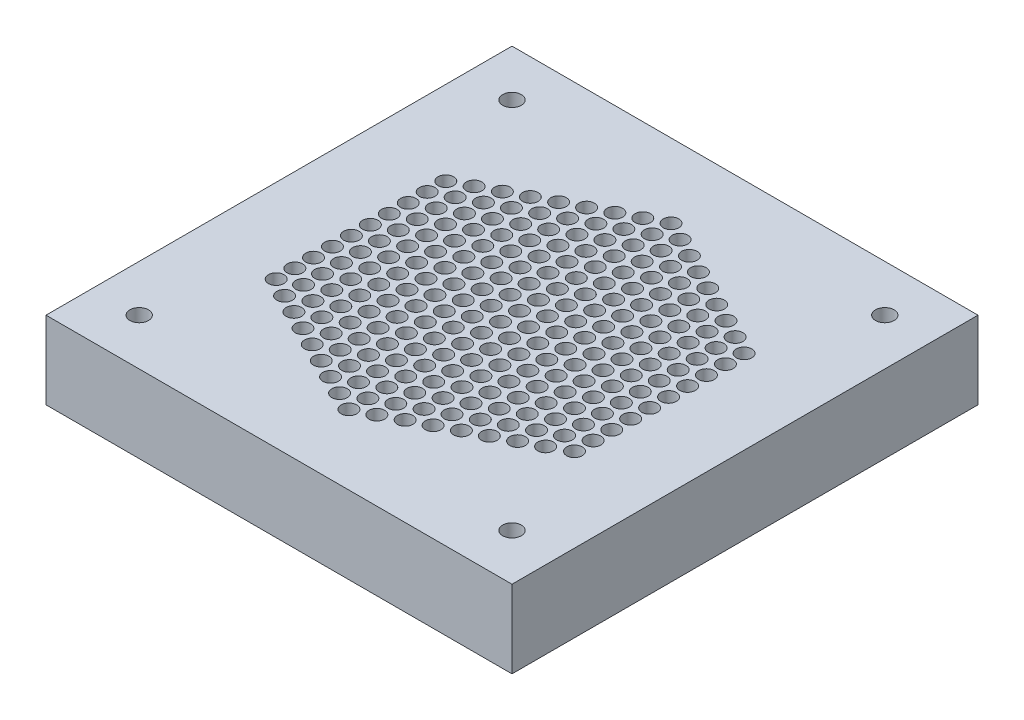
from build123d import *

# Parameters (mm, degrees)
SKETCH1_W        = 150
SKETCH1_H        = 150
SKETCH1_R        = 2.5
EXTRUSION2_DEPTH = 25
SKETCH2_R        = 3
EXTRUSION3_DEPTH = 25


with BuildPart() as part:
    # Sketch1 → Extrusion2 (new body)
    with BuildSketch(Plane(origin=(0, 0, 0), x_dir=(-1, 0, 0), z_dir=(0, 1, 0))):
        Rectangle(SKETCH1_W, SKETCH1_H)
        with Locations(Location((0, 52.5, 0), (0, 0, 90))):
            Circle(SKETCH1_R, mode=Mode.SUBTRACT)
        with Locations(Location((0, 46.4, 0), (0, 0, 90))):
            Circle(SKETCH1_R, mode=Mode.SUBTRACT)
        with Locations(Location((0, 40.3, 0), (0, 0, 90))):
            Circle(SKETCH1_R, mode=Mode.SUBTRACT)
        with Locations(Location((0, 34.2, 0), (0, 0, 90))):
            Circle(SKETCH1_R, mode=Mode.SUBTRACT)
        with Locations(Location((0, 28.1, 0), (0, 0, 90))):
            Circle(SKETCH1_R, mode=Mode.SUBTRACT)
        with Locations(Location((0, 22, 0), (0, 0, 90))):
            Circle(SKETCH1_R, mode=Mode.SUBTRACT)
        with Locations(Location((0, 15.9, 0), (0, 0, 90))):
            Circle(SKETCH1_R, mode=Mode.SUBTRACT)
        with Locations(Location((0, 9.8, 0), (0, 0, 90))):
            Circle(SKETCH1_R, mode=Mode.SUBTRACT)
        with Locations(Location((0, 3.7, 0), (0, 0, 90))):
            Circle(SKETCH1_R, mode=Mode.SUBTRACT)
        with Locations(Location((0, -2.4, 0), (0, 0, 90))):
            Circle(SKETCH1_R, mode=Mode.SUBTRACT)
        with Locations(Location((0, -8.5, 0), (0, 0, 90))):
            Circle(SKETCH1_R, mode=Mode.SUBTRACT)
        with Locations(Location((0, -14.6, 0), (0, 0, 90))):
            Circle(SKETCH1_R, mode=Mode.SUBTRACT)
        with Locations(Location((0, -20.7, 0), (0, 0, 90))):
            Circle(SKETCH1_R, mode=Mode.SUBTRACT)
        with Locations(Location((0, -26.8, 0), (0, 0, 90))):
            Circle(SKETCH1_R, mode=Mode.SUBTRACT)
        with Locations(Location((0, -32.9, 0), (0, 0, 90))):
            Circle(SKETCH1_R, mode=Mode.SUBTRACT)
        with Locations(Location((0, -39, 0), (0, 0, 90))):
            Circle(SKETCH1_R, mode=Mode.SUBTRACT)
        with Locations(Location((0, -45.1, 0), (0, 0, 90))):
            Circle(SKETCH1_R, mode=Mode.SUBTRACT)
        with Locations(Location((0, -51.2, 0), (0, 0, 90))):
            Circle(SKETCH1_R, mode=Mode.SUBTRACT)
        with Locations(Location((6, -35.9, 0), (0, 0, 90))):
            Circle(SKETCH1_R, mode=Mode.SUBTRACT)
        with Locations(Location((6, -29.8, 0), (0, 0, 90))):
            Circle(SKETCH1_R, mode=Mode.SUBTRACT)
        with Locations(Location((6, -42, 0), (0, 0, 90))):
            Circle(SKETCH1_R, mode=Mode.SUBTRACT)
        with Locations(Location((6, -48.1, 0), (0, 0, 90))):
            Circle(SKETCH1_R, mode=Mode.SUBTRACT)
        with Locations(Location((6, -23.7, 0), (0, 0, 90))):
            Circle(SKETCH1_R, mode=Mode.SUBTRACT)
        with Locations(Location((6, -17.6, 0), (0, 0, 90))):
            Circle(SKETCH1_R, mode=Mode.SUBTRACT)
        with Locations(Location((6, -11.5, 0), (0, 0, 90))):
            Circle(SKETCH1_R, mode=Mode.SUBTRACT)
        with Locations(Location((6, -5.4, 0), (0, 0, 90))):
            Circle(SKETCH1_R, mode=Mode.SUBTRACT)
        with Locations(Location((6, 0.7, 0), (0, 0, 90))):
            Circle(SKETCH1_R, mode=Mode.SUBTRACT)
        with Locations(Location((6, 19, 0), (0, 0, 90))):
            Circle(SKETCH1_R, mode=Mode.SUBTRACT)
        with Locations(Location((6, 12.9, 0), (0, 0, 90))):
            Circle(SKETCH1_R, mode=Mode.SUBTRACT)
        with Locations(Location((6, 6.8, 0), (0, 0, 90))):
            Circle(SKETCH1_R, mode=Mode.SUBTRACT)
        with Locations(Location((6, 37.3, 0), (0, 0, 90))):
            Circle(SKETCH1_R, mode=Mode.SUBTRACT)
        with Locations(Location((6, 31.2, 0), (0, 0, 90))):
            Circle(SKETCH1_R, mode=Mode.SUBTRACT)
        with Locations(Location((6, 25.1, 0), (0, 0, 90))):
            Circle(SKETCH1_R, mode=Mode.SUBTRACT)
        with Locations(Location((6, 43.4, 0), (0, 0, 90))):
            Circle(SKETCH1_R, mode=Mode.SUBTRACT)
        with Locations(Location((6, 49.5, 0), (0, 0, 90))):
            Circle(SKETCH1_R, mode=Mode.SUBTRACT)
        with Locations(Location((18, -23.7, 0), (0, 0, 90))):
            Circle(SKETCH1_R, mode=Mode.SUBTRACT)
        with Locations(Location((18, -35.9, 0), (0, 0, 90))):
            Circle(SKETCH1_R, mode=Mode.SUBTRACT)
        with Locations(Location((18, -29.8, 0), (0, 0, 90))):
            Circle(SKETCH1_R, mode=Mode.SUBTRACT)
        with Locations(Location((18, -42, 0), (0, 0, 90))):
            Circle(SKETCH1_R, mode=Mode.SUBTRACT)
        with Locations(Location((18, -11.5, 0), (0, 0, 90))):
            Circle(SKETCH1_R, mode=Mode.SUBTRACT)
        with Locations(Location((18, -17.6, 0), (0, 0, 90))):
            Circle(SKETCH1_R, mode=Mode.SUBTRACT)
        with Locations(Location((18, -5.4, 0), (0, 0, 90))):
            Circle(SKETCH1_R, mode=Mode.SUBTRACT)
        with Locations(Location((18, 0.7, 0), (0, 0, 90))):
            Circle(SKETCH1_R, mode=Mode.SUBTRACT)
        with Locations(Location((18, 6.8, 0), (0, 0, 90))):
            Circle(SKETCH1_R, mode=Mode.SUBTRACT)
        with Locations(Location((18, 12.9, 0), (0, 0, 90))):
            Circle(SKETCH1_R, mode=Mode.SUBTRACT)
        with Locations(Location((18, 25.1, 0), (0, 0, 90))):
            Circle(SKETCH1_R, mode=Mode.SUBTRACT)
        with Locations(Location((18, 31.2, 0), (0, 0, 90))):
            Circle(SKETCH1_R, mode=Mode.SUBTRACT)
        with Locations(Location((18, 37.3, 0), (0, 0, 90))):
            Circle(SKETCH1_R, mode=Mode.SUBTRACT)
        with Locations(Location((18, 43.4, 0), (0, 0, 90))):
            Circle(SKETCH1_R, mode=Mode.SUBTRACT)
        with Locations(Location((18, 19, 0), (0, 0, 90))):
            Circle(SKETCH1_R, mode=Mode.SUBTRACT)
        with Locations(Location((30, -23.7, 0), (0, 0, 90))):
            Circle(SKETCH1_R, mode=Mode.SUBTRACT)
        with Locations(Location((30, -35.9, 0), (0, 0, 90))):
            Circle(SKETCH1_R, mode=Mode.SUBTRACT)
        with Locations(Location((30, -29.8, 0), (0, 0, 90))):
            Circle(SKETCH1_R, mode=Mode.SUBTRACT)
        with Locations(Location((30, -11.5, 0), (0, 0, 90))):
            Circle(SKETCH1_R, mode=Mode.SUBTRACT)
        with Locations(Location((30, -17.6, 0), (0, 0, 90))):
            Circle(SKETCH1_R, mode=Mode.SUBTRACT)
        with Locations(Location((30, -5.4, 0), (0, 0, 90))):
            Circle(SKETCH1_R, mode=Mode.SUBTRACT)
        with Locations(Location((30, 0.7, 0), (0, 0, 90))):
            Circle(SKETCH1_R, mode=Mode.SUBTRACT)
        with Locations(Location((30, 6.8, 0), (0, 0, 90))):
            Circle(SKETCH1_R, mode=Mode.SUBTRACT)
        with Locations(Location((30, 12.9, 0), (0, 0, 90))):
            Circle(SKETCH1_R, mode=Mode.SUBTRACT)
        with Locations(Location((30, 25.1, 0), (0, 0, 90))):
            Circle(SKETCH1_R, mode=Mode.SUBTRACT)
        with Locations(Location((30, 31.2, 0), (0, 0, 90))):
            Circle(SKETCH1_R, mode=Mode.SUBTRACT)
        with Locations(Location((30, 37.3, 0), (0, 0, 90))):
            Circle(SKETCH1_R, mode=Mode.SUBTRACT)
        with Locations(Location((30, 19, 0), (0, 0, 90))):
            Circle(SKETCH1_R, mode=Mode.SUBTRACT)
        with Locations(Location((42, -23.7, 0), (0, 0, 90))):
            Circle(SKETCH1_R, mode=Mode.SUBTRACT)
        with Locations(Location((42, -29.8, 0), (0, 0, 90))):
            Circle(SKETCH1_R, mode=Mode.SUBTRACT)
        with Locations(Location((42, -11.5, 0), (0, 0, 90))):
            Circle(SKETCH1_R, mode=Mode.SUBTRACT)
        with Locations(Location((42, -17.6, 0), (0, 0, 90))):
            Circle(SKETCH1_R, mode=Mode.SUBTRACT)
        with Locations(Location((42, -5.4, 0), (0, 0, 90))):
            Circle(SKETCH1_R, mode=Mode.SUBTRACT)
        with Locations(Location((42, 0.7, 0), (0, 0, 90))):
            Circle(SKETCH1_R, mode=Mode.SUBTRACT)
        with Locations(Location((42, 6.8, 0), (0, 0, 90))):
            Circle(SKETCH1_R, mode=Mode.SUBTRACT)
        with Locations(Location((42, 12.9, 0), (0, 0, 90))):
            Circle(SKETCH1_R, mode=Mode.SUBTRACT)
        with Locations(Location((42, 25.1, 0), (0, 0, 90))):
            Circle(SKETCH1_R, mode=Mode.SUBTRACT)
        with Locations(Location((42, 31.2, 0), (0, 0, 90))):
            Circle(SKETCH1_R, mode=Mode.SUBTRACT)
        with Locations(Location((42, 19, 0), (0, 0, 90))):
            Circle(SKETCH1_R, mode=Mode.SUBTRACT)
        with Locations(Location((-6, -23.7, 0), (0, 0, 90))):
            Circle(SKETCH1_R, mode=Mode.SUBTRACT)
        with Locations(Location((-6, -35.9, 0), (0, 0, 90))):
            Circle(SKETCH1_R, mode=Mode.SUBTRACT)
        with Locations(Location((-6, -29.8, 0), (0, 0, 90))):
            Circle(SKETCH1_R, mode=Mode.SUBTRACT)
        with Locations(Location((-6, -42, 0), (0, 0, 90))):
            Circle(SKETCH1_R, mode=Mode.SUBTRACT)
        with Locations(Location((-6, -48.1, 0), (0, 0, 90))):
            Circle(SKETCH1_R, mode=Mode.SUBTRACT)
        with Locations(Location((-6, -11.5, 0), (0, 0, 90))):
            Circle(SKETCH1_R, mode=Mode.SUBTRACT)
        with Locations(Location((-6, -17.6, 0), (0, 0, 90))):
            Circle(SKETCH1_R, mode=Mode.SUBTRACT)
        with Locations(Location((-6, -5.4, 0), (0, 0, 90))):
            Circle(SKETCH1_R, mode=Mode.SUBTRACT)
        with Locations(Location((-6, 0.7, 0), (0, 0, 90))):
            Circle(SKETCH1_R, mode=Mode.SUBTRACT)
        with Locations(Location((-6, 6.8, 0), (0, 0, 90))):
            Circle(SKETCH1_R, mode=Mode.SUBTRACT)
        with Locations(Location((-6, 12.9, 0), (0, 0, 90))):
            Circle(SKETCH1_R, mode=Mode.SUBTRACT)
        with Locations(Location((-6, 25.1, 0), (0, 0, 90))):
            Circle(SKETCH1_R, mode=Mode.SUBTRACT)
        with Locations(Location((-6, 31.2, 0), (0, 0, 90))):
            Circle(SKETCH1_R, mode=Mode.SUBTRACT)
        with Locations(Location((-6, 37.3, 0), (0, 0, 90))):
            Circle(SKETCH1_R, mode=Mode.SUBTRACT)
        with Locations(Location((-6, 43.4, 0), (0, 0, 90))):
            Circle(SKETCH1_R, mode=Mode.SUBTRACT)
        with Locations(Location((-6, 19, 0), (0, 0, 90))):
            Circle(SKETCH1_R, mode=Mode.SUBTRACT)
        with Locations(Location((-6, 49.5, 0), (0, 0, 90))):
            Circle(SKETCH1_R, mode=Mode.SUBTRACT)
        with Locations(Location((-18, -23.7, 0), (0, 0, 90))):
            Circle(SKETCH1_R, mode=Mode.SUBTRACT)
        with Locations(Location((-18, -35.9, 0), (0, 0, 90))):
            Circle(SKETCH1_R, mode=Mode.SUBTRACT)
        with Locations(Location((-18, -29.8, 0), (0, 0, 90))):
            Circle(SKETCH1_R, mode=Mode.SUBTRACT)
        with Locations(Location((-18, -42, 0), (0, 0, 90))):
            Circle(SKETCH1_R, mode=Mode.SUBTRACT)
        with Locations(Location((-18, -11.5, 0), (0, 0, 90))):
            Circle(SKETCH1_R, mode=Mode.SUBTRACT)
        with Locations(Location((-18, -17.6, 0), (0, 0, 90))):
            Circle(SKETCH1_R, mode=Mode.SUBTRACT)
        with Locations(Location((-18, -5.4, 0), (0, 0, 90))):
            Circle(SKETCH1_R, mode=Mode.SUBTRACT)
        with Locations(Location((-18, 0.7, 0), (0, 0, 90))):
            Circle(SKETCH1_R, mode=Mode.SUBTRACT)
        with Locations(Location((-18, 6.8, 0), (0, 0, 90))):
            Circle(SKETCH1_R, mode=Mode.SUBTRACT)
        with Locations(Location((-18, 12.9, 0), (0, 0, 90))):
            Circle(SKETCH1_R, mode=Mode.SUBTRACT)
        with Locations(Location((-18, 25.1, 0), (0, 0, 90))):
            Circle(SKETCH1_R, mode=Mode.SUBTRACT)
        with Locations(Location((-18, 31.2, 0), (0, 0, 90))):
            Circle(SKETCH1_R, mode=Mode.SUBTRACT)
        with Locations(Location((-18, 37.3, 0), (0, 0, 90))):
            Circle(SKETCH1_R, mode=Mode.SUBTRACT)
        with Locations(Location((-18, 43.4, 0), (0, 0, 90))):
            Circle(SKETCH1_R, mode=Mode.SUBTRACT)
        with Locations(Location((-18, 19, 0), (0, 0, 90))):
            Circle(SKETCH1_R, mode=Mode.SUBTRACT)
        with Locations(Location((-30, -23.7, 0), (0, 0, 90))):
            Circle(SKETCH1_R, mode=Mode.SUBTRACT)
        with Locations(Location((-30, -35.9, 0), (0, 0, 90))):
            Circle(SKETCH1_R, mode=Mode.SUBTRACT)
        with Locations(Location((-30, -29.8, 0), (0, 0, 90))):
            Circle(SKETCH1_R, mode=Mode.SUBTRACT)
        with Locations(Location((-30, -11.5, 0), (0, 0, 90))):
            Circle(SKETCH1_R, mode=Mode.SUBTRACT)
        with Locations(Location((-30, -17.6, 0), (0, 0, 90))):
            Circle(SKETCH1_R, mode=Mode.SUBTRACT)
        with Locations(Location((-30, -5.4, 0), (0, 0, 90))):
            Circle(SKETCH1_R, mode=Mode.SUBTRACT)
        with Locations(Location((-30, 0.7, 0), (0, 0, 90))):
            Circle(SKETCH1_R, mode=Mode.SUBTRACT)
        with Locations(Location((-30, 6.8, 0), (0, 0, 90))):
            Circle(SKETCH1_R, mode=Mode.SUBTRACT)
        with Locations(Location((-30, 12.9, 0), (0, 0, 90))):
            Circle(SKETCH1_R, mode=Mode.SUBTRACT)
        with Locations(Location((-30, 25.1, 0), (0, 0, 90))):
            Circle(SKETCH1_R, mode=Mode.SUBTRACT)
        with Locations(Location((-30, 31.2, 0), (0, 0, 90))):
            Circle(SKETCH1_R, mode=Mode.SUBTRACT)
        with Locations(Location((-30, 37.3, 0), (0, 0, 90))):
            Circle(SKETCH1_R, mode=Mode.SUBTRACT)
        with Locations(Location((-30, 19, 0), (0, 0, 90))):
            Circle(SKETCH1_R, mode=Mode.SUBTRACT)
        with Locations(Location((-42, -23.7, 0), (0, 0, 90))):
            Circle(SKETCH1_R, mode=Mode.SUBTRACT)
        with Locations(Location((-42, -29.8, 0), (0, 0, 90))):
            Circle(SKETCH1_R, mode=Mode.SUBTRACT)
        with Locations(Location((-42, -11.5, 0), (0, 0, 90))):
            Circle(SKETCH1_R, mode=Mode.SUBTRACT)
        with Locations(Location((-42, -17.6, 0), (0, 0, 90))):
            Circle(SKETCH1_R, mode=Mode.SUBTRACT)
        with Locations(Location((-42, -5.4, 0), (0, 0, 90))):
            Circle(SKETCH1_R, mode=Mode.SUBTRACT)
        with Locations(Location((-42, 0.7, 0), (0, 0, 90))):
            Circle(SKETCH1_R, mode=Mode.SUBTRACT)
        with Locations(Location((-42, 6.8, 0), (0, 0, 90))):
            Circle(SKETCH1_R, mode=Mode.SUBTRACT)
        with Locations(Location((-42, 12.9, 0), (0, 0, 90))):
            Circle(SKETCH1_R, mode=Mode.SUBTRACT)
        with Locations(Location((-42, 25.1, 0), (0, 0, 90))):
            Circle(SKETCH1_R, mode=Mode.SUBTRACT)
        with Locations(Location((-42, 31.2, 0), (0, 0, 90))):
            Circle(SKETCH1_R, mode=Mode.SUBTRACT)
        with Locations(Location((-42, 19, 0), (0, 0, 90))):
            Circle(SKETCH1_R, mode=Mode.SUBTRACT)
        with Locations(Location((-12, -32.9, 0), (0, 0, 90))):
            Circle(SKETCH1_R, mode=Mode.SUBTRACT)
        with Locations(Location((-12, -39, 0), (0, 0, 90))):
            Circle(SKETCH1_R, mode=Mode.SUBTRACT)
        with Locations(Location((-12, -45.1, 0), (0, 0, 90))):
            Circle(SKETCH1_R, mode=Mode.SUBTRACT)
        with Locations(Location((-12, -2.4, 0), (0, 0, 90))):
            Circle(SKETCH1_R, mode=Mode.SUBTRACT)
        with Locations(Location((-12, -8.5, 0), (0, 0, 90))):
            Circle(SKETCH1_R, mode=Mode.SUBTRACT)
        with Locations(Location((-12, -14.6, 0), (0, 0, 90))):
            Circle(SKETCH1_R, mode=Mode.SUBTRACT)
        with Locations(Location((-12, -26.8, 0), (0, 0, 90))):
            Circle(SKETCH1_R, mode=Mode.SUBTRACT)
        with Locations(Location((-12, -20.7, 0), (0, 0, 90))):
            Circle(SKETCH1_R, mode=Mode.SUBTRACT)
        with Locations(Location((-12, 3.7, 0), (0, 0, 90))):
            Circle(SKETCH1_R, mode=Mode.SUBTRACT)
        with Locations(Location((-12, 28.1, 0), (0, 0, 90))):
            Circle(SKETCH1_R, mode=Mode.SUBTRACT)
        with Locations(Location((-12, 22, 0), (0, 0, 90))):
            Circle(SKETCH1_R, mode=Mode.SUBTRACT)
        with Locations(Location((-12, 15.9, 0), (0, 0, 90))):
            Circle(SKETCH1_R, mode=Mode.SUBTRACT)
        with Locations(Location((-12, 9.8, 0), (0, 0, 90))):
            Circle(SKETCH1_R, mode=Mode.SUBTRACT)
        with Locations(Location((-12, 40.3, 0), (0, 0, 90))):
            Circle(SKETCH1_R, mode=Mode.SUBTRACT)
        with Locations(Location((-12, 34.2, 0), (0, 0, 90))):
            Circle(SKETCH1_R, mode=Mode.SUBTRACT)
        with Locations(Location((-12, 46.4, 0), (0, 0, 90))):
            Circle(SKETCH1_R, mode=Mode.SUBTRACT)
        with Locations(Location((-24, -32.9, 0), (0, 0, 90))):
            Circle(SKETCH1_R, mode=Mode.SUBTRACT)
        with Locations(Location((-24, -39, 0), (0, 0, 90))):
            Circle(SKETCH1_R, mode=Mode.SUBTRACT)
        with Locations(Location((-24, -2.4, 0), (0, 0, 90))):
            Circle(SKETCH1_R, mode=Mode.SUBTRACT)
        with Locations(Location((-24, -8.5, 0), (0, 0, 90))):
            Circle(SKETCH1_R, mode=Mode.SUBTRACT)
        with Locations(Location((-24, -14.6, 0), (0, 0, 90))):
            Circle(SKETCH1_R, mode=Mode.SUBTRACT)
        with Locations(Location((-24, -26.8, 0), (0, 0, 90))):
            Circle(SKETCH1_R, mode=Mode.SUBTRACT)
        with Locations(Location((-24, -20.7, 0), (0, 0, 90))):
            Circle(SKETCH1_R, mode=Mode.SUBTRACT)
        with Locations(Location((-24, 3.7, 0), (0, 0, 90))):
            Circle(SKETCH1_R, mode=Mode.SUBTRACT)
        with Locations(Location((-24, 28.1, 0), (0, 0, 90))):
            Circle(SKETCH1_R, mode=Mode.SUBTRACT)
        with Locations(Location((-24, 22, 0), (0, 0, 90))):
            Circle(SKETCH1_R, mode=Mode.SUBTRACT)
        with Locations(Location((-24, 15.9, 0), (0, 0, 90))):
            Circle(SKETCH1_R, mode=Mode.SUBTRACT)
        with Locations(Location((-24, 9.8, 0), (0, 0, 90))):
            Circle(SKETCH1_R, mode=Mode.SUBTRACT)
        with Locations(Location((-24, 40.3, 0), (0, 0, 90))):
            Circle(SKETCH1_R, mode=Mode.SUBTRACT)
        with Locations(Location((-24, 34.2, 0), (0, 0, 90))):
            Circle(SKETCH1_R, mode=Mode.SUBTRACT)
        with Locations(Location((-36, -32.9, 0), (0, 0, 90))):
            Circle(SKETCH1_R, mode=Mode.SUBTRACT)
        with Locations(Location((-36, -2.4, 0), (0, 0, 90))):
            Circle(SKETCH1_R, mode=Mode.SUBTRACT)
        with Locations(Location((-36, -8.5, 0), (0, 0, 90))):
            Circle(SKETCH1_R, mode=Mode.SUBTRACT)
        with Locations(Location((-36, -14.6, 0), (0, 0, 90))):
            Circle(SKETCH1_R, mode=Mode.SUBTRACT)
        with Locations(Location((-36, -26.8, 0), (0, 0, 90))):
            Circle(SKETCH1_R, mode=Mode.SUBTRACT)
        with Locations(Location((-36, -20.7, 0), (0, 0, 90))):
            Circle(SKETCH1_R, mode=Mode.SUBTRACT)
        with Locations(Location((-36, 3.7, 0), (0, 0, 90))):
            Circle(SKETCH1_R, mode=Mode.SUBTRACT)
        with Locations(Location((-36, 28.1, 0), (0, 0, 90))):
            Circle(SKETCH1_R, mode=Mode.SUBTRACT)
        with Locations(Location((-36, 22, 0), (0, 0, 90))):
            Circle(SKETCH1_R, mode=Mode.SUBTRACT)
        with Locations(Location((-36, 15.9, 0), (0, 0, 90))):
            Circle(SKETCH1_R, mode=Mode.SUBTRACT)
        with Locations(Location((-36, 9.8, 0), (0, 0, 90))):
            Circle(SKETCH1_R, mode=Mode.SUBTRACT)
        with Locations(Location((-36, 34.2, 0), (0, 0, 90))):
            Circle(SKETCH1_R, mode=Mode.SUBTRACT)
        with Locations(Location((24, -32.9, 0), (0, 0, 90))):
            Circle(SKETCH1_R, mode=Mode.SUBTRACT)
        with Locations(Location((24, -39, 0), (0, 0, 90))):
            Circle(SKETCH1_R, mode=Mode.SUBTRACT)
        with Locations(Location((24, -2.4, 0), (0, 0, 90))):
            Circle(SKETCH1_R, mode=Mode.SUBTRACT)
        with Locations(Location((24, -8.5, 0), (0, 0, 90))):
            Circle(SKETCH1_R, mode=Mode.SUBTRACT)
        with Locations(Location((24, -14.6, 0), (0, 0, 90))):
            Circle(SKETCH1_R, mode=Mode.SUBTRACT)
        with Locations(Location((24, -26.8, 0), (0, 0, 90))):
            Circle(SKETCH1_R, mode=Mode.SUBTRACT)
        with Locations(Location((24, -20.7, 0), (0, 0, 90))):
            Circle(SKETCH1_R, mode=Mode.SUBTRACT)
        with Locations(Location((24, 3.7, 0), (0, 0, 90))):
            Circle(SKETCH1_R, mode=Mode.SUBTRACT)
        with Locations(Location((24, 28.1, 0), (0, 0, 90))):
            Circle(SKETCH1_R, mode=Mode.SUBTRACT)
        with Locations(Location((24, 22, 0), (0, 0, 90))):
            Circle(SKETCH1_R, mode=Mode.SUBTRACT)
        with Locations(Location((24, 15.9, 0), (0, 0, 90))):
            Circle(SKETCH1_R, mode=Mode.SUBTRACT)
        with Locations(Location((24, 9.8, 0), (0, 0, 90))):
            Circle(SKETCH1_R, mode=Mode.SUBTRACT)
        with Locations(Location((24, 40.3, 0), (0, 0, 90))):
            Circle(SKETCH1_R, mode=Mode.SUBTRACT)
        with Locations(Location((24, 34.2, 0), (0, 0, 90))):
            Circle(SKETCH1_R, mode=Mode.SUBTRACT)
        with Locations(Location((36, -32.9, 0), (0, 0, 90))):
            Circle(SKETCH1_R, mode=Mode.SUBTRACT)
        with Locations(Location((36, -2.4, 0), (0, 0, 90))):
            Circle(SKETCH1_R, mode=Mode.SUBTRACT)
        with Locations(Location((36, -8.5, 0), (0, 0, 90))):
            Circle(SKETCH1_R, mode=Mode.SUBTRACT)
        with Locations(Location((36, -14.6, 0), (0, 0, 90))):
            Circle(SKETCH1_R, mode=Mode.SUBTRACT)
        with Locations(Location((36, -26.8, 0), (0, 0, 90))):
            Circle(SKETCH1_R, mode=Mode.SUBTRACT)
        with Locations(Location((36, -20.7, 0), (0, 0, 90))):
            Circle(SKETCH1_R, mode=Mode.SUBTRACT)
        with Locations(Location((36, 3.7, 0), (0, 0, 90))):
            Circle(SKETCH1_R, mode=Mode.SUBTRACT)
        with Locations(Location((36, 28.1, 0), (0, 0, 90))):
            Circle(SKETCH1_R, mode=Mode.SUBTRACT)
        with Locations(Location((36, 22, 0), (0, 0, 90))):
            Circle(SKETCH1_R, mode=Mode.SUBTRACT)
        with Locations(Location((36, 15.9, 0), (0, 0, 90))):
            Circle(SKETCH1_R, mode=Mode.SUBTRACT)
        with Locations(Location((36, 9.8, 0), (0, 0, 90))):
            Circle(SKETCH1_R, mode=Mode.SUBTRACT)
        with Locations(Location((36, 34.2, 0), (0, 0, 90))):
            Circle(SKETCH1_R, mode=Mode.SUBTRACT)
        with Locations(Location((48, -2.4, 0), (0, 0, 90))):
            Circle(SKETCH1_R, mode=Mode.SUBTRACT)
        with Locations(Location((48, -8.5, 0), (0, 0, 90))):
            Circle(SKETCH1_R, mode=Mode.SUBTRACT)
        with Locations(Location((48, -14.6, 0), (0, 0, 90))):
            Circle(SKETCH1_R, mode=Mode.SUBTRACT)
        with Locations(Location((48, -20.7, 0), (0, 0, 90))):
            Circle(SKETCH1_R, mode=Mode.SUBTRACT)
        with Locations(Location((48, 3.7, 0), (0, 0, 90))):
            Circle(SKETCH1_R, mode=Mode.SUBTRACT)
        with Locations(Location((48, 15.9, 0), (0, 0, 90))):
            Circle(SKETCH1_R, mode=Mode.SUBTRACT)
        with Locations(Location((48, 9.8, 0), (0, 0, 90))):
            Circle(SKETCH1_R, mode=Mode.SUBTRACT)
        with Locations(Location((12, -32.9, 0), (0, 0, 90))):
            Circle(SKETCH1_R, mode=Mode.SUBTRACT)
        with Locations(Location((12, -39, 0), (0, 0, 90))):
            Circle(SKETCH1_R, mode=Mode.SUBTRACT)
        with Locations(Location((12, -45.1, 0), (0, 0, 90))):
            Circle(SKETCH1_R, mode=Mode.SUBTRACT)
        with Locations(Location((12, -2.4, 0), (0, 0, 90))):
            Circle(SKETCH1_R, mode=Mode.SUBTRACT)
        with Locations(Location((12, -8.5, 0), (0, 0, 90))):
            Circle(SKETCH1_R, mode=Mode.SUBTRACT)
        with Locations(Location((12, -14.6, 0), (0, 0, 90))):
            Circle(SKETCH1_R, mode=Mode.SUBTRACT)
        with Locations(Location((12, -26.8, 0), (0, 0, 90))):
            Circle(SKETCH1_R, mode=Mode.SUBTRACT)
        with Locations(Location((12, -20.7, 0), (0, 0, 90))):
            Circle(SKETCH1_R, mode=Mode.SUBTRACT)
        with Locations(Location((12, 3.7, 0), (0, 0, 90))):
            Circle(SKETCH1_R, mode=Mode.SUBTRACT)
        with Locations(Location((12, 28.1, 0), (0, 0, 90))):
            Circle(SKETCH1_R, mode=Mode.SUBTRACT)
        with Locations(Location((12, 22, 0), (0, 0, 90))):
            Circle(SKETCH1_R, mode=Mode.SUBTRACT)
        with Locations(Location((12, 15.9, 0), (0, 0, 90))):
            Circle(SKETCH1_R, mode=Mode.SUBTRACT)
        with Locations(Location((12, 9.8, 0), (0, 0, 90))):
            Circle(SKETCH1_R, mode=Mode.SUBTRACT)
        with Locations(Location((12, 40.3, 0), (0, 0, 90))):
            Circle(SKETCH1_R, mode=Mode.SUBTRACT)
        with Locations(Location((12, 34.2, 0), (0, 0, 90))):
            Circle(SKETCH1_R, mode=Mode.SUBTRACT)
        with Locations(Location((12, 46.4, 0), (0, 0, 90))):
            Circle(SKETCH1_R, mode=Mode.SUBTRACT)
        with Locations(Location((-48, -2.4, 0), (0, 0, 90))):
            Circle(SKETCH1_R, mode=Mode.SUBTRACT)
        with Locations(Location((-48, -8.5, 0), (0, 0, 90))):
            Circle(SKETCH1_R, mode=Mode.SUBTRACT)
        with Locations(Location((-48, -14.6, 0), (0, 0, 90))):
            Circle(SKETCH1_R, mode=Mode.SUBTRACT)
        with Locations(Location((-48, -20.7, 0), (0, 0, 90))):
            Circle(SKETCH1_R, mode=Mode.SUBTRACT)
        with Locations(Location((-48, 3.7, 0), (0, 0, 90))):
            Circle(SKETCH1_R, mode=Mode.SUBTRACT)
        with Locations(Location((-48, 15.9, 0), (0, 0, 90))):
            Circle(SKETCH1_R, mode=Mode.SUBTRACT)
        with Locations(Location((-48, 9.8, 0), (0, 0, 90))):
            Circle(SKETCH1_R, mode=Mode.SUBTRACT)
        with Locations(Location((48, 21.9, 0), (0, 0, 90))):
            Circle(SKETCH1_R, mode=Mode.SUBTRACT)
        with Locations(Location((48, 27.9, 0), (0, 0, 90))):
            Circle(SKETCH1_R, mode=Mode.SUBTRACT)
        with Locations(Location((48, -26.7, 0), (0, 0, 90))):
            Circle(SKETCH1_R, mode=Mode.SUBTRACT)
        with Locations(Location((-48, 21.9, 0), (0, 0, 90))):
            Circle(SKETCH1_R, mode=Mode.SUBTRACT)
        with Locations(Location((-48, 27.9, 0), (0, 0, 90))):
            Circle(SKETCH1_R, mode=Mode.SUBTRACT)
        with Locations(Location((-48, -26.7, 0), (0, 0, 90))):
            Circle(SKETCH1_R, mode=Mode.SUBTRACT)
    extrude(amount=EXTRUSION2_DEPTH)

    # Sketch2 → Extrusion3 (cut)
    with BuildSketch(Plane.XZ):
        with Locations(Location((-60, 60, 0), (0, 0, 270))):
            Circle(SKETCH2_R)
        with Locations(Location((60, 60, 0), (0, 0, 270))):
            Circle(SKETCH2_R)
        with Locations(Location((60, -60, 0), (0, 0, 270))):
            Circle(SKETCH2_R)
        with Locations(Location((-60, -60, 0), (0, 0, 270))):
            Circle(SKETCH2_R)
    extrude(amount=-EXTRUSION3_DEPTH, mode=Mode.SUBTRACT)


solid = part.part
